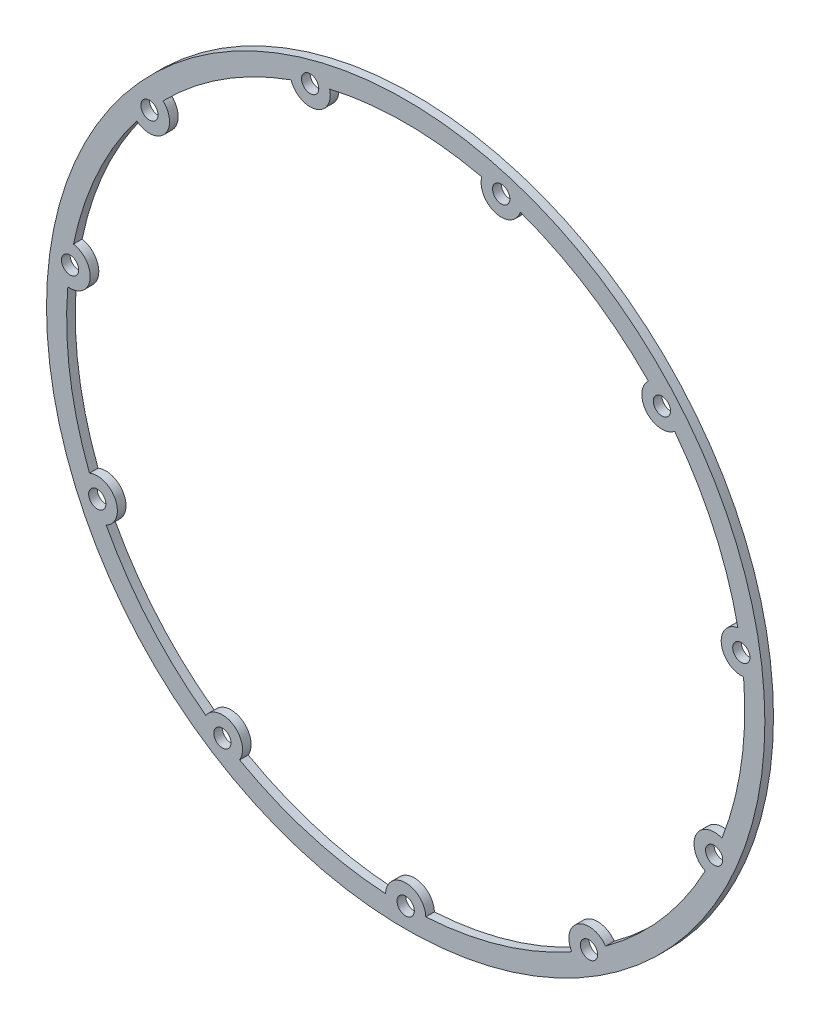
from build123d import *

# Parameters (mm, degrees)
SKETCH_1_R      = 62.5
SKETCH_1_R_2    = 1.5
EXTRUDE_1_DEPTH = 1.5


with BuildPart() as part:
    # 草图1 → 凸台-拉伸1 (new body)
    with BuildSketch(Plane.XY):
        Circle(SKETCH_1_R)
        with Locations((0, -59)):
            Circle(SKETCH_1_R_2, mode=Mode.SUBTRACT)
        with Locations((-31.89780823, -49.633958437)):
            Circle(SKETCH_1_R_2, mode=Mode.SUBTRACT)
        with Locations((-53.668287726, -24.509485767)):
            Circle(SKETCH_1_R_2, mode=Mode.SUBTRACT)
        with Locations((-58.399465071, 8.396575458)):
            Circle(SKETCH_1_R_2, mode=Mode.SUBTRACT)
        with Locations((-44.589224887, 38.636783303)):
            Circle(SKETCH_1_R_2, mode=Mode.SUBTRACT)
        with Locations((-16.622220854, 56.610085443)):
            Circle(SKETCH_1_R_2, mode=Mode.SUBTRACT)
        with Locations((16.622220854, 56.610085443)):
            Circle(SKETCH_1_R_2, mode=Mode.SUBTRACT)
        with Locations((44.589224887, 38.636783303)):
            Circle(SKETCH_1_R_2, mode=Mode.SUBTRACT)
        with Locations((58.399465071, 8.396575458)):
            Circle(SKETCH_1_R_2, mode=Mode.SUBTRACT)
        with Locations((53.668287726, -24.509485767)):
            Circle(SKETCH_1_R_2, mode=Mode.SUBTRACT)
        with Locations((31.89780823, -49.633958437)):
            Circle(SKETCH_1_R_2, mode=Mode.SUBTRACT)
        with BuildLine():
            ThreePointArc((3.498460053, -58.896186441), (0, -55.5), (-3.498460053, -58.896186441))
            ThreePointArc((-3.498460053, -58.896186441), (-16.622220854, -56.610085443), (-28.898590503, -51.438035217))
            ThreePointArc((-28.898590503, -51.438035217), (-30.005565369, -46.689571072), (-34.784774262, -47.65521461))
            ThreePointArc((-34.784774262, -47.65521461), (-44.589224887, -38.636783303), (-52.120542762, -27.648671255))
            ThreePointArc((-52.120542762, -27.648671255), (-50.484575742, -23.055533222), (-55.027168419, -21.284048857))
            ThreePointArc((-55.027168419, -21.284048857), (-58.399465071, -8.396575458), (-58.794590961, 4.918950474))
            ThreePointArc((-58.794590961, 4.918950474), (-54.935090024, 7.898473524), (-57.798825407, 11.844652023))
            ThreePointArc((-57.798825407, 11.844652023), (-53.668287726, 24.509485767), (-46.801771952, 35.924840183))
            ThreePointArc((-46.801771952, 35.924840183), (-41.944101377, 36.344770734), (-42.219763715, 41.212759575))
            ThreePointArc((-42.219763715, 41.212759575), (-31.89780823, 49.633958437), (-19.949721034, 55.524846967))
            ThreePointArc((-19.949721034, 55.524846967), (-15.636156905, 53.251860036), (-13.236225354, 57.496107158))
            ThreePointArc((-13.236225354, 57.496107158), (0, 59), (13.236225354, 57.496107158))
            ThreePointArc((13.236225354, 57.496107158), (15.636156905, 53.251860036), (19.949721034, 55.524846967))
            ThreePointArc((19.949721034, 55.524846967), (31.89780823, 49.633958437), (42.219763715, 41.212759575))
            ThreePointArc((42.219763715, 41.212759575), (41.944101377, 36.344770734), (46.801771952, 35.924840183))
            ThreePointArc((46.801771952, 35.924840183), (53.668287726, 24.509485767), (57.798825407, 11.844652023))
            ThreePointArc((57.798825407, 11.844652023), (54.935090024, 7.898473524), (58.794590961, 4.918950474))
            ThreePointArc((58.794590961, 4.918950474), (58.399465071, -8.396575458), (55.027168419, -21.284048857))
            ThreePointArc((55.027168419, -21.284048857), (50.484575742, -23.055533222), (52.120542762, -27.648671255))
            ThreePointArc((52.120542762, -27.648671255), (44.589224887, -38.636783303), (34.784774262, -47.65521461))
            ThreePointArc((34.784774262, -47.65521461), (30.005565369, -46.689571072), (28.898590503, -51.438035217))
            ThreePointArc((28.898590503, -51.438035217), (16.622220854, -56.610085443), (3.498460053, -58.896186441))
        make_face(mode=Mode.SUBTRACT)
    extrude(amount=EXTRUDE_1_DEPTH)


solid = part.part
